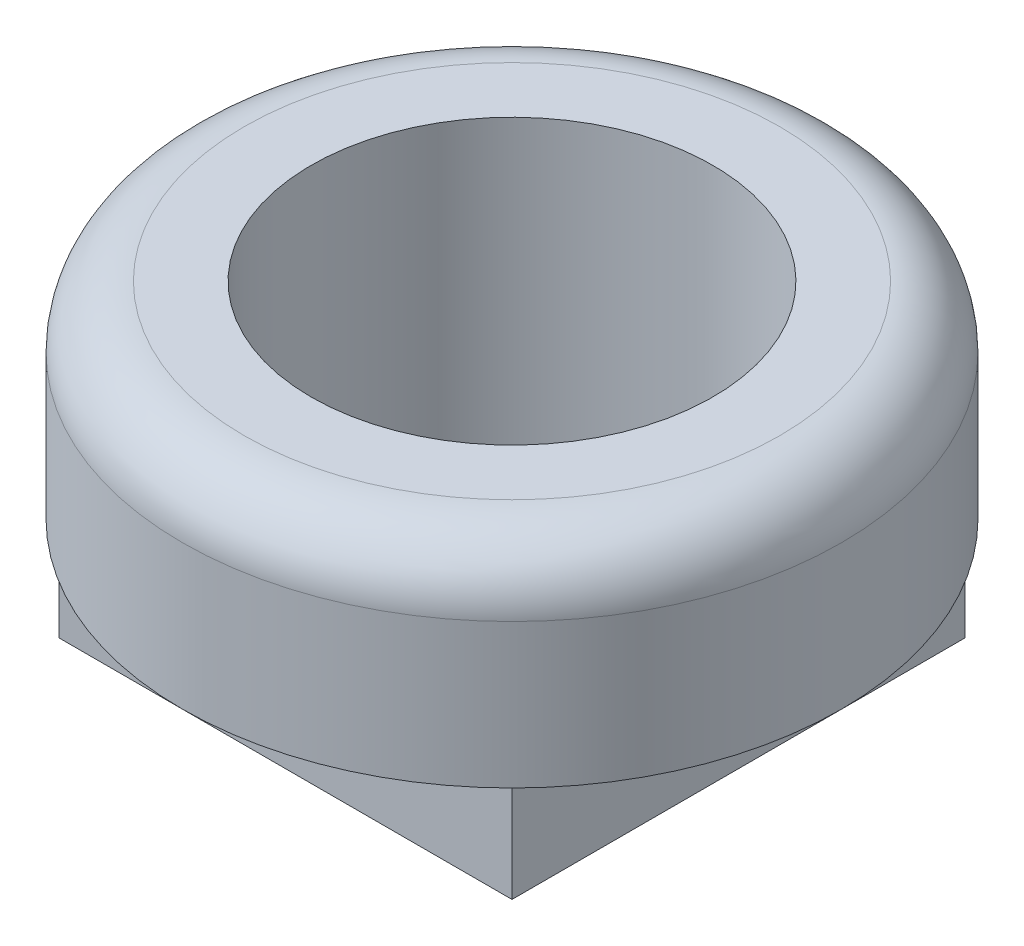
from build123d import *

# Parameters (mm, degrees)
SKETCH1_R           = 16
BOSS_EXTRUDE1_DEPTH = 10
SKETCH2_W           = 22
SKETCH2_H           = 22
BOSS_EXTRUDE2_DEPTH = 5
SKETCH3_R           = 9.75
CUT_EXTRUDE1_DEPTH  = 28.147743921
FILLET1_R           = 3


with BuildPart() as part:
    # Sketch1 → Boss-Extrude1 (new body)
    with BuildSketch(Plane(origin=(0, 0, 0), x_dir=(1, 0, 0), z_dir=(0, 1, 0))):
        with Locations(Location((0, 0, 0), (0, 0, 270))):
            Circle(SKETCH1_R)
    extrude(amount=BOSS_EXTRUDE1_DEPTH)

    # Sketch2 → Boss-Extrude2 (add)
    with BuildSketch(Plane.XZ):
        Rectangle(SKETCH2_W, SKETCH2_H)
    extrude(amount=BOSS_EXTRUDE2_DEPTH)

    # Sketch3 → Cut-Extrude1 (cut, through all)
    with BuildSketch(Plane(origin=(0, 10, 0), x_dir=(1, 0, 0), z_dir=(0, 1, 0))):
        with Locations(Location((0, 0, 0), (0, 0, 270))):
            Circle(SKETCH3_R)
    extrude(amount=-CUT_EXTRUDE1_DEPTH, mode=Mode.SUBTRACT)

    # Fillet1
    fillet1_edges = [part.edges().sort_by_distance(p)[0] for p in [
        (0, 10, -16),
    ]]
    fillet(fillet1_edges, radius=FILLET1_R)


solid = part.part
